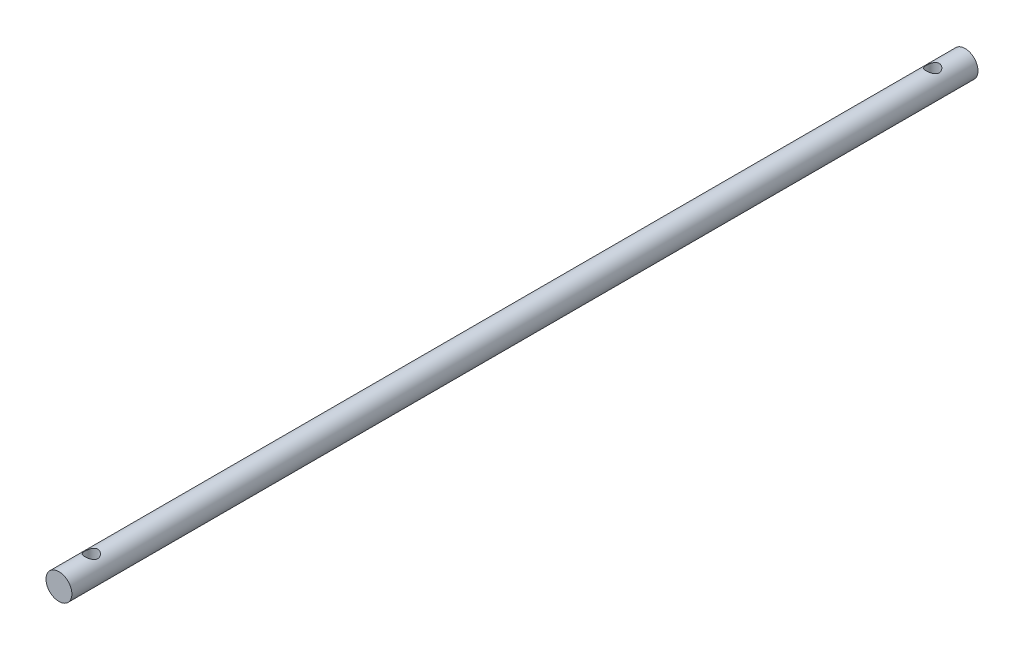
from build123d import *

# Parameters (mm, degrees)
SKETCH1_R                         = 4
EXTRUDE1_DEPTH                    = 280
SKETCH3_W                         = 2
SKETCH3_H                         = 4
F_4_0_4_DIAMETER_HOLE1_AT_2_COUNT = 2
F_4_0_4_DIAMETER_HOLE1_AT_2_PITCH = 260


with BuildPart() as part:
    # Sketch1 → Extrude1 (new body)
    with BuildSketch(Plane.XY):
        Circle(SKETCH1_R)
    extrude(amount=EXTRUDE1_DEPTH)

    # Sketch3 → Ø4.0 (4) Diameter Hole1 (revolve, cut)
    with BuildSketch(Plane(origin=(0, 0, 10), x_dir=(0, 0, -1), z_dir=(1, 0, 0))):
        with Locations((1, 2)):
            Rectangle(SKETCH3_W, SKETCH3_H)
    f_4_0_4_diameter_hole1 = revolve(axis=Axis((0, -6.35, 10), (0, 1, 0)), mode=Mode.SUBTRACT)

    # Ø4.0 (4) Diameter Hole1 at 2: Ø4.0 (4) Diameter Hole1 ×2
    with Locations(*[(0, 0, i * F_4_0_4_DIAMETER_HOLE1_AT_2_PITCH) for i in range(1, F_4_0_4_DIAMETER_HOLE1_AT_2_COUNT)]):
        add(f_4_0_4_diameter_hole1, mode=Mode.SUBTRACT)


solid = part.part
